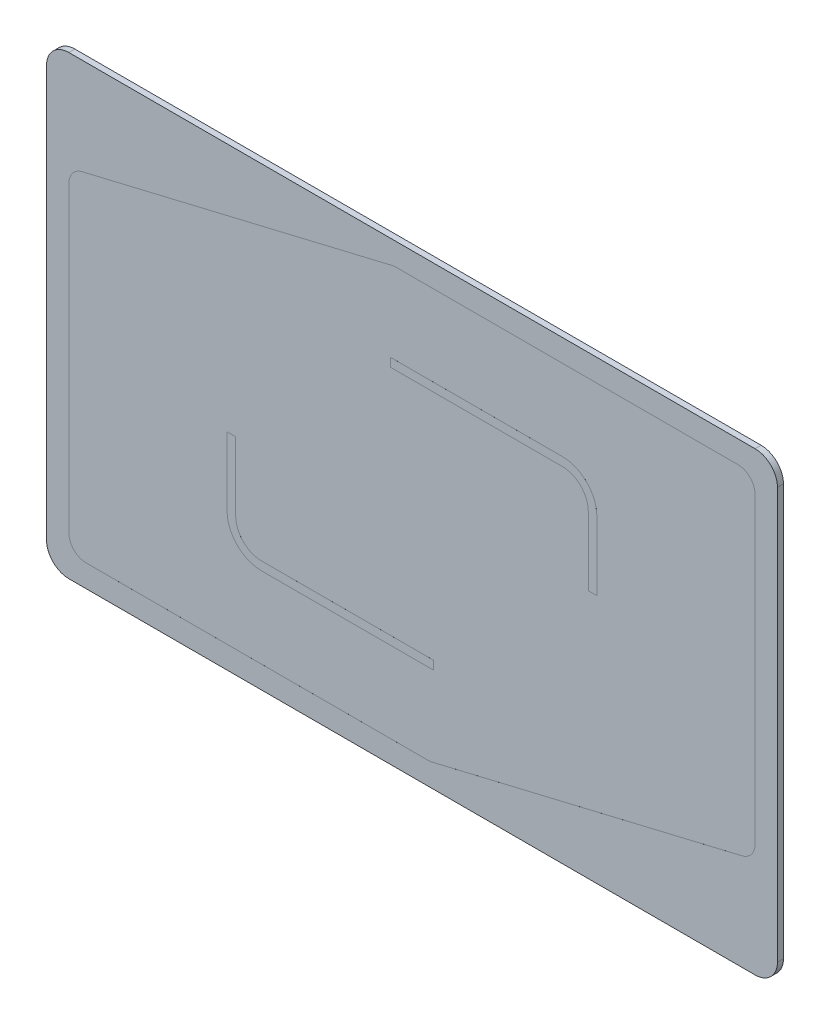
from build123d import *

# Parameters (mm, degrees)
EXTRUDE_1_DEPTH = 0.7
EXTRUDE_2_DEPTH = 0.001
EXTRUDE_5_DEPTH = 0.001


with BuildPart() as part:
    # Эскиз1 → Бобышка-Вытянуть1 (new body)
    with BuildSketch(Plane.XY):
        with BuildLine():
            Line((-39.9, 26.5), (39.9, 26.5))
            ThreePointArc((39.9, 26.5), (41.738477631, 25.738477631), (42.5, 23.9))
            Line((42.5, 23.9), (42.5, -23.9))
            ThreePointArc((42.5, -23.9), (41.738477631, -25.738477631), (39.9, -26.5))
            Line((39.9, -26.5), (-39.9, -26.5))
            ThreePointArc((-39.9, -26.5), (-41.738477631, -25.738477631), (-42.5, -23.9))
            Line((-42.5, -23.9), (-42.5, 23.9))
            ThreePointArc((-42.5, 23.9), (-41.738477631, 25.738477631), (-39.9, 26.5))
        make_face()
    extrude(amount=EXTRUDE_1_DEPTH)

    # Эскиз2 → Бобышка-Вытянуть2 (add)
    with BuildSketch(Plane.XY.offset(0.7)):
        with BuildLine():
            Line((-42.5, -23.9), (-42.5, 23.9))
            ThreePointArc((-42.5, 23.9), (-41.738477631, 25.738477631), (-39.9, 26.5))
            Line((-39.9, 26.5), (39.9, 26.5))
            ThreePointArc((39.9, 26.5), (41.738477631, 25.738477631), (42.5, 23.9))
            Line((42.5, 23.9), (42.5, -23.9))
            ThreePointArc((42.5, -23.9), (41.738477631, -25.738477631), (39.9, -26.5))
            Line((39.9, -26.5), (-39.9, -26.5))
            ThreePointArc((-39.9, -26.5), (-41.738477631, -25.738477631), (-42.5, -23.9))
        make_face()
        with BuildLine():
            Line((37.9, 23.9), (-1.865186742, 23.9))
            ThreePointArc((-1.865186742, 23.9), (-2.098398171, 23.886356572), (-2.328427797, 23.845612429))
            Line((-2.328427797, 23.845612429), (-38.363241055, 15.265894987))
            ThreePointArc((-38.363241055, 15.265894987), (-39.469471585, 14.559943376), (-39.9, 13.320282558))
            Line((-39.9, 13.320282558), (-39.9, -21.9))
            ThreePointArc((-39.9, -21.9), (-39.314213562, -23.314213562), (-37.9, -23.9))
            Line((-37.9, -23.9), (1.865186742, -23.9))
            ThreePointArc((1.865186742, -23.9), (2.098398171, -23.886356572), (2.328427797, -23.845612429))
            Line((2.328427797, -23.845612429), (38.363241055, -15.265894987))
            ThreePointArc((38.363241055, -15.265894987), (39.469471585, -14.559943376), (39.9, -13.320282558))
            Line((39.9, -13.320282558), (39.9, 21.9))
            ThreePointArc((39.9, 21.9), (39.314213562, 23.314213562), (37.9, 23.9))
        make_face(mode=Mode.SUBTRACT)
    extrude(amount=EXTRUDE_2_DEPTH)

    # Эскиз11 → Бобышка-Вытянуть5 (add)
    with BuildSketch(Plane.XY.offset(0.7)):
        with BuildLine():
            Line((-17.5, -13.5), (2.5, -13.5))
            Line((2.5, -13.5), (2.5, -14.5))
            Line((2.5, -14.5), (-17.5, -14.5))
            ThreePointArc((-17.5, -14.5), (-20.328427125, -13.328427125), (-21.5, -10.5))
            Line((-21.5, -10.5), (-21.5, -2.5))
            Line((-21.5, -2.5), (-20.5, -2.5))
            Line((-20.5, -2.5), (-20.5, -10.5))
            ThreePointArc((-20.5, -10.5), (-19.621320344, -12.621320344), (-17.5, -13.5))
        make_face()
        with BuildLine():
            Line((17.5, 13.5), (-2.5, 13.5))
            Line((-2.5, 13.5), (-2.5, 14.5))
            Line((-2.5, 14.5), (17.5, 14.5))
            ThreePointArc((17.5, 14.5), (20.328427125, 13.328427125), (21.5, 10.5))
            Line((21.5, 10.5), (21.5, 2.5))
            Line((21.5, 2.5), (20.5, 2.5))
            Line((20.5, 2.5), (20.5, 10.5))
            ThreePointArc((20.5, 10.5), (19.621320344, 12.621320344), (17.5, 13.5))
        make_face()
    extrude(amount=EXTRUDE_5_DEPTH)


solid = part.part
